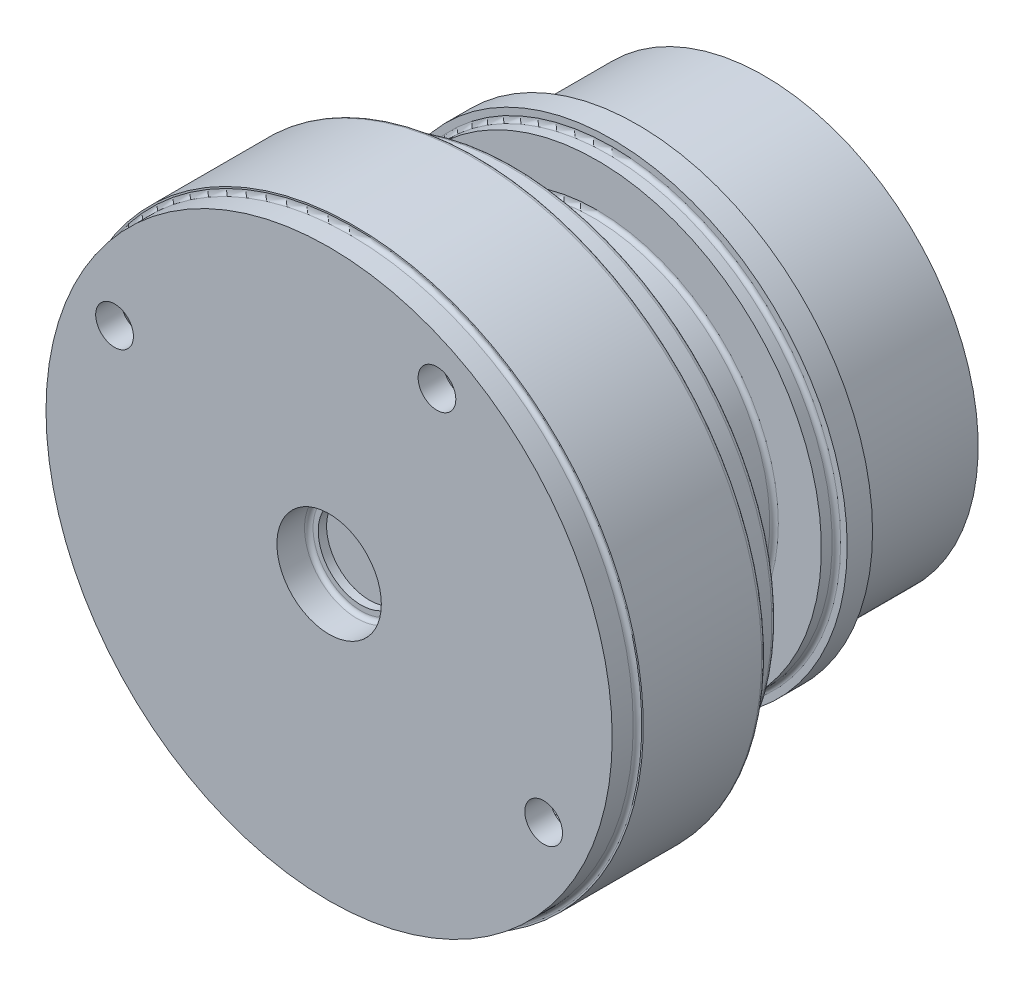
from build123d import *

# Parameters (mm, degrees)
SKETCH1_R            = 168.0000069
SKETCH1_R_2          = 11.19
BOSS_EXTRUDE1_DEPTH  = 14.999999718
SKETCH2_R            = 171.45
BOSS_EXTRUDE2_DEPTH  = 94.60000003
SKETCH3_R            = 105.0000186
BOSS_EXTRUDE3_DEPTH  = 49.44799991
SKETCH4_R            = 133.096
BOSS_EXTRUDE4_DEPTH  = 8.903999718
SKETCH5_R            = 139.4999877
BOSS_EXTRUDE5_DEPTH  = 15.048000384
SKETCH6_R            = 127
BOSS_EXTRUDE10_DEPTH = 75.179999754
SKETCH11_R           = 25.4
CUT_EXTRUDE1_DEPTH   = 355.185145297
SKETCH12_R           = 30.988
CUT_EXTRUDE2_DEPTH   = 18.923
CUT_EXTRUDE3_START   = -17.78
SKETCH13_R           = 30.988
CUT_EXTRUDE3_DEPTH   = 17.78
FILLET1_R            = 2.54
FILLET2_R            = 2.54
FILLET3_R            = 2.54
SKETCH16_W           = 38.49843195
SKETCH16_H           = 31.452188168
FILLET4_R            = 2.54
FILLET5_R            = 2.54


with BuildPart() as part:
    # Sketch1 → Boss-Extrude1 (new body)
    with BuildSketch(Plane.XY):
        Circle(SKETCH1_R)
        with Locations((-127.320286932, 63.998394789)):
            Circle(SKETCH1_R_2, mode=Mode.SUBTRACT)
        with Locations((63.998394789, 127.320286932)):
            Circle(SKETCH1_R_2, mode=Mode.SUBTRACT)
        with Locations((127.320286932, -63.998394789)):
            Circle(SKETCH1_R_2, mode=Mode.SUBTRACT)
    extrude(amount=-BOSS_EXTRUDE1_DEPTH)

    # Sketch2 → Boss-Extrude2 (add)
    with BuildSketch(Plane(origin=(0, 0, -14.999999718), x_dir=(-1, 0, 0), z_dir=(0, 0, -1))):
        Circle(SKETCH2_R)
    extrude(amount=BOSS_EXTRUDE2_DEPTH)

    # Sketch3 → Boss-Extrude3 (add)
    with BuildSketch(Plane(origin=(0, 0, -109.599999748), x_dir=(-1, 0, 0), z_dir=(0, 0, -1))):
        Circle(SKETCH3_R)
    extrude(amount=BOSS_EXTRUDE3_DEPTH)

    # Sketch4 → Boss-Extrude4 (add)
    with BuildSketch(Plane(origin=(0, 0, -159.047999658), x_dir=(-1, 0, 0), z_dir=(0, 0, -1))):
        Circle(SKETCH4_R)
    extrude(amount=BOSS_EXTRUDE4_DEPTH)

    # Sketch5 → Boss-Extrude5 (add)
    with BuildSketch(Plane(origin=(0, 0, -167.951999376), x_dir=(-1, 0, 0), z_dir=(0, 0, -1))):
        with Locations(Location((0, 0, 0), (0, 0, 180))):
            Circle(SKETCH5_R)
    extrude(amount=BOSS_EXTRUDE5_DEPTH)

    # Sketch6 → Boss-Extrude10 (add)
    with BuildSketch(Plane(origin=(0, 0, -182.99999976), x_dir=(-1, 0, 0), z_dir=(0, 0, -1))):
        Circle(SKETCH6_R)
    extrude(amount=BOSS_EXTRUDE10_DEPTH)

    # Sketch11 → Cut-Extrude1 (cut, through all)
    with BuildSketch(Plane.XY):
        Circle(SKETCH11_R)
    extrude(amount=-CUT_EXTRUDE1_DEPTH, mode=Mode.SUBTRACT)

    # Sketch12 → Cut-Extrude2 (cut)
    with BuildSketch(Plane.XY):
        Circle(SKETCH12_R)
    extrude(amount=-CUT_EXTRUDE2_DEPTH, mode=Mode.SUBTRACT)

    # Sketch13 → Cut-Extrude3 (cut)
    with BuildSketch(Plane(origin=(0, 0, -258.179999514), x_dir=(-1, 0, 0), z_dir=(0, 0, -1)).offset(CUT_EXTRUDE3_START)):
        with Locations(Location((0, 0, 0), (0, 0, 180))):
            Circle(SKETCH13_R)
    extrude(amount=CUT_EXTRUDE3_DEPTH, mode=Mode.SUBTRACT)

    # Sketch14 → Cut-Revolve1 (revolve, cut)
    with BuildSketch(Plane(origin=(0, 0, 0), x_dir=(1, 0, 0), z_dir=(0, 1, 0)), mode=Mode.PRIVATE) as cut_revolve1_sk:
        Polygon((19.647479787, 234.539764691), (35.564425438, 234.539764691), (35.564425438, 247.223580756), (96.496483005, 247.223580756), (96.496483005, 234.539764691), (96.496483005, 101.418748628), (147.925724351, 101.418748628), (147.925724351, 79.09597863), (165.138311123, 79.09597863), (165.138311123, 14.999999718), (38.300150471, 14.999999718), (38.300150471, 23.888937099), (19.647479787, 23.888937099), align=None)
    revolve(cut_revolve1_sk.sketch.rotate(Axis((0, 0, -258.179999514), (0, 0, 1)), 180), axis=Axis((0, 0, -258.179999514), (0, 0, 1)), mode=Mode.SUBTRACT)

    # Fillet1
    fillet1_edges = [part.edges().sort_by_distance(p)[0] for p in [
        (-168.0000069, 0, -14.999999718),
        (171.45, 0, -109.599999748),
        (105.0000186, 0, -109.599999748),
        (105.0000186, 0, -159.047999658),
        (133.096, 0, -167.951999376),
        (127, 0, -182.99999976),
        (-30.988, 0, -18.923),
        (-30.988, 0, -240.399999514),
    ]]
    fillet(fillet1_edges, radius=FILLET1_R)

    # Fillet2
    fillet2_edges = [part.edges().sort_by_distance(p)[0] for p in [
        (165.138311123, 0, -79.09597863),
        (165.138311123, 0, -14.999999718),
        (96.496483005, 0, -247.223580756),
    ]]
    fillet(fillet2_edges, radius=FILLET2_R)

    # Fillet3
    fillet3_edges = [part.edges().sort_by_distance(p)[0] for p in [
        (38.300150471, 0, -14.999999718),
        (35.564425438, 0, -234.539764691),
        (38.300150471, 0, -23.888937099),
        (35.564425438, 0, -247.223580756),
    ]]
    fillet(fillet3_edges, radius=FILLET3_R)

    # Sketch16 → Cut-Revolve2 (revolve, cut)
    with BuildSketch(Plane(origin=(0, 0, 0), x_dir=(0, 0, -1), z_dir=(1, 0, 0)), mode=Mode.PRIVATE) as cut_revolve2_sk:
        with Locations((107.059999748, 171.45)):
            Rectangle(SKETCH16_W, SKETCH16_H)
    revolve(cut_revolve2_sk.sketch.rotate(Axis((0, 0, 0), (0, 0, -1)), 90), axis=Axis((0, 0, 0), (0, 0, -1)), mode=Mode.SUBTRACT)

    # Fillet4
    fillet4_edges = [part.edges().sort_by_distance(p)[0] for p in [
        (96.496483005, 0, -101.418748628),
        (147.925724351, 0, -101.418748628),
        (147.925724351, 0, -79.09597863),
    ]]
    fillet(fillet4_edges, radius=FILLET4_R)

    # Fillet5
    fillet5_edges = [part.edges().sort_by_distance(p)[0] for p in [
        (171.45, 0, -87.810783773),
        (-155.723905916, 0, -109.599999748),
        (-155.723905916, 0, -87.810783773),
    ]]
    fillet(fillet5_edges, radius=FILLET5_R)


solid = part.part
